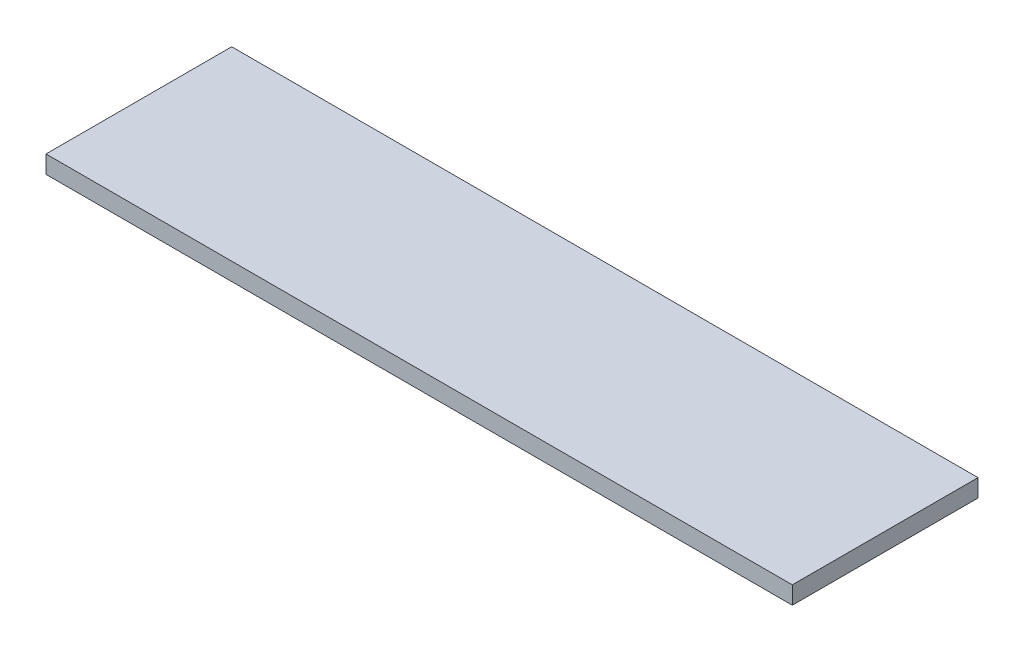
from build123d import *

# Parameters (mm, degrees)
SKETCH_1_W      = 42.2
SKETCH_1_H      = 10.5
EXTRUDE_1_DEPTH = 1


with BuildPart() as part:
    # 草图1 → 凸台-拉伸1 (new body)
    with BuildSketch(Plane(origin=(0, 0, 0), x_dir=(1, 0, 0), z_dir=(0, 1, 0))):
        Rectangle(SKETCH_1_W, SKETCH_1_H)
    extrude(amount=EXTRUDE_1_DEPTH)


solid = part.part
